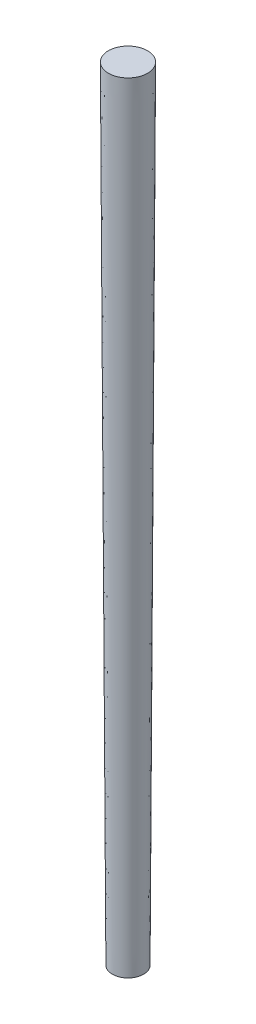
from build123d import *


with BuildPart() as part:
    # Sketch1 → Revolve1 (revolve)
    with BuildSketch(Plane.XY, mode=Mode.PRIVATE) as revolve1_sk:
        Polygon((0, 63.5), (0, -63.5), (-2.54, -63.5), (-3.175, 63.5), align=None)
    revolve(revolve1_sk.sketch.rotate(Axis((0, 63.5, 0), (0, -1, 0)), 270), axis=Axis((0, 63.5, 0), (0, -1, 0)))


solid = part.part
